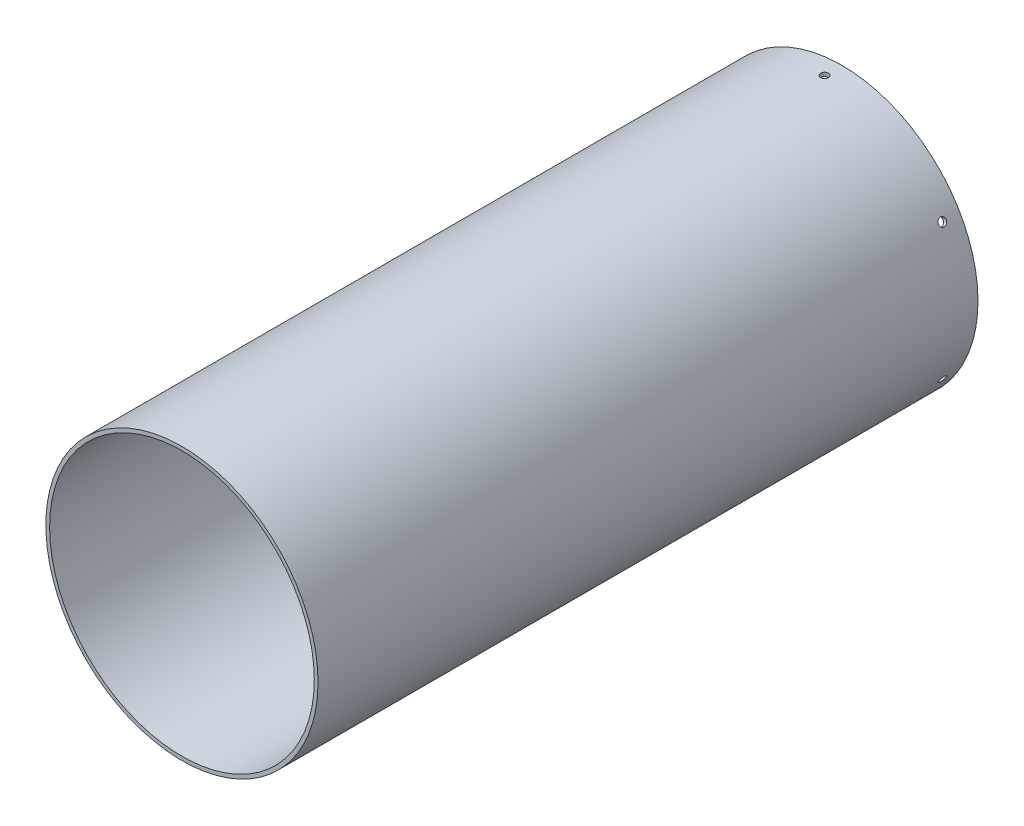
from build123d import *

# Parameters (mm, degrees)
SKETCH1_R           = 78.359
SKETCH1_R_2         = 76.2
BOSS_EXTRUDE1_DEPTH = 380
SKETCH5_W           = 2.25
SKETCH5_H           = 78.359
CIRPATTERN2_COUNT   = 6


with BuildPart() as part:
    # Sketch1 → Boss-Extrude1 (new body)
    with BuildSketch(Plane.XY):
        Circle(SKETCH1_R)
        Circle(SKETCH1_R_2, mode=Mode.SUBTRACT)
    extrude(amount=BOSS_EXTRUDE1_DEPTH)

    # Sketch5 → M4 Clearance Hole2 (revolve, cut)
    with BuildSketch(Plane(origin=(0, 0, 10), x_dir=(0, 0, -1), z_dir=(1, 0, 0))):
        with Locations((1.125, 39.1795)):
            Rectangle(SKETCH5_W, SKETCH5_H)
    m4_clearance_hole2 = revolve(axis=Axis((0, -6.35, 10), (0, 1, 0)), mode=Mode.SUBTRACT)

    # CirPattern2: M4 Clearance Hole2 ×6 about axis
    cirpattern2_axis = Axis((0, 0, 380), (0, 0, -1))
    for i in range(1, CIRPATTERN2_COUNT):
        add(m4_clearance_hole2.rotate(cirpattern2_axis, i * 360 / CIRPATTERN2_COUNT), mode=Mode.SUBTRACT)


solid = part.part
